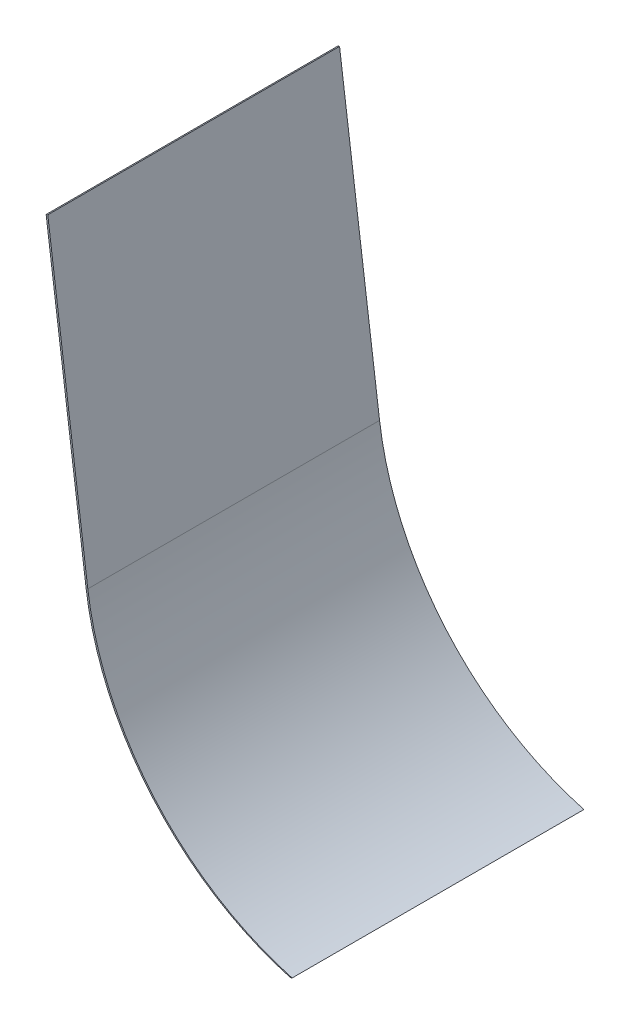
from build123d import *

# Parameters (mm, degrees)
BOSS_EXTRUDE1_DEPTH = 536.448


with BuildPart() as part:
    # Sketch1 → Boss-Extrude1 (new body)
    with BuildSketch(Plane.XY):
        with BuildLine():
            Line((-22.255838535, 1100.134706491), (51.311577116, 541.334706491))
            ThreePointArc((51.311577116, 541.334706491), (174.106371442, 268.871620715), (426.943161465, 109.534706491))
            Line((426.943161465, 109.534706491), (429.973784979, 110.481250793))
            ThreePointArc((429.973784979, 110.481250793), (177.136994956, 269.818165018), (54.34220063, 542.281250793))
            Line((54.34220063, 542.281250793), (-19.225215021, 1101.081250793))
            Line((-19.225215021, 1101.081250793), (-22.255838535, 1100.134706491))
        make_face()
    extrude(amount=BOSS_EXTRUDE1_DEPTH)


solid = part.part
